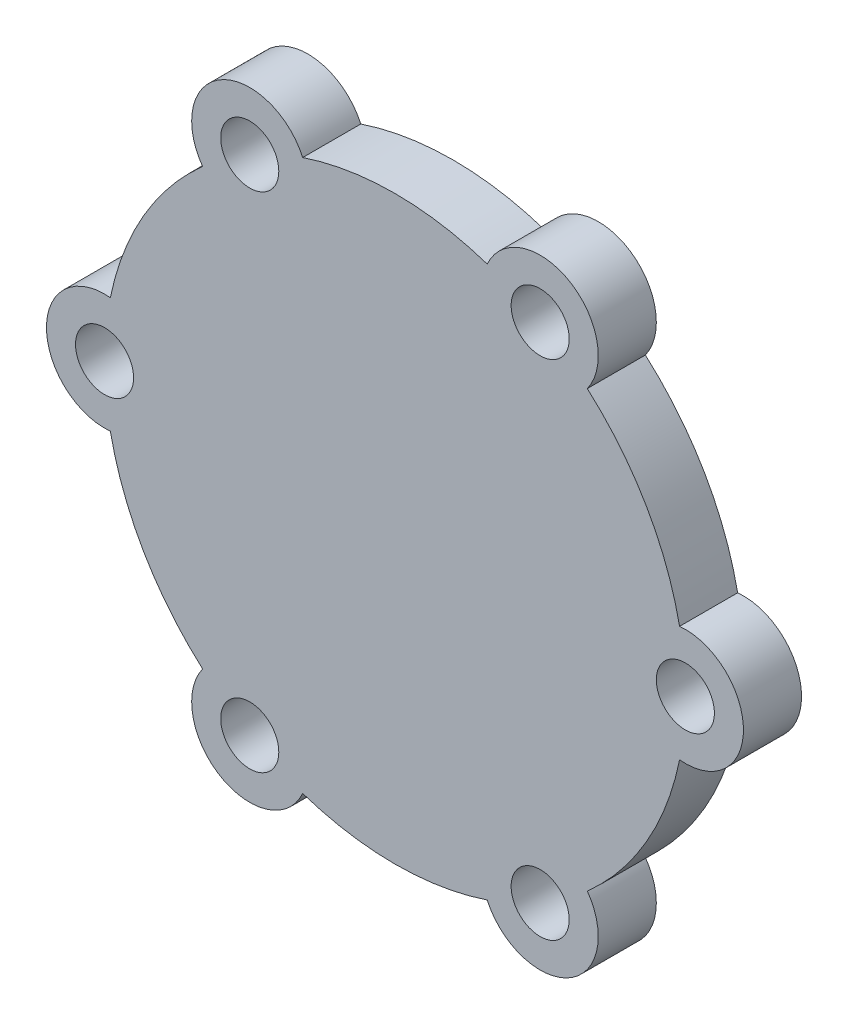
from build123d import *

# Parameters (mm, degrees)
SKETCH2_R           = 5
BOSS_EXTRUDE1_DEPTH = 10


with BuildPart() as part:
    # Sketch2 → Boss-Extrude1 (new body)
    with BuildSketch(Plane.XY):
        with BuildLine():
            ThreePointArc((49, 9.949874371), (43.301270189, 25), (33.11684397, 37.4603076))
            ThreePointArc((33.11684397, 37.4603076), (30, 51.961524227), (15.88315603, 47.410181971))
            ThreePointArc((15.88315603, 47.410181971), (0, 50), (-15.88315603, 47.410181971))
            ThreePointArc((-15.88315603, 47.410181971), (-30, 51.961524227), (-33.11684397, 37.4603076))
            ThreePointArc((-33.11684397, 37.4603076), (-43.301270189, 25), (-49, 9.949874371))
            ThreePointArc((-49, 9.949874371), (-60, 0), (-49, -9.949874371))
            ThreePointArc((-49, -9.949874371), (-43.301270189, -25), (-33.11684397, -37.4603076))
            ThreePointArc((-33.11684397, -37.4603076), (-30, -51.961524227), (-15.88315603, -47.410181971))
            ThreePointArc((-15.88315603, -47.410181971), (0, -50), (15.88315603, -47.410181971))
            ThreePointArc((15.88315603, -47.410181971), (30, -51.961524227), (33.11684397, -37.4603076))
            ThreePointArc((33.11684397, -37.4603076), (43.301270189, -25), (49, -9.949874371))
            ThreePointArc((49, -9.949874371), (60, 0), (49, 9.949874371))
        make_face()
        with Locations((50, 0)):
            Circle(SKETCH2_R, mode=Mode.SUBTRACT)
        with Locations((25, -43.301270189)):
            Circle(SKETCH2_R, mode=Mode.SUBTRACT)
        with Locations((-25, -43.301270189)):
            Circle(SKETCH2_R, mode=Mode.SUBTRACT)
        with Locations((-50, 0)):
            Circle(SKETCH2_R, mode=Mode.SUBTRACT)
        with Locations((-25, 43.301270189)):
            Circle(SKETCH2_R, mode=Mode.SUBTRACT)
        with Locations((25, 43.301270189)):
            Circle(SKETCH2_R, mode=Mode.SUBTRACT)
    extrude(amount=BOSS_EXTRUDE1_DEPTH)


solid = part.part
